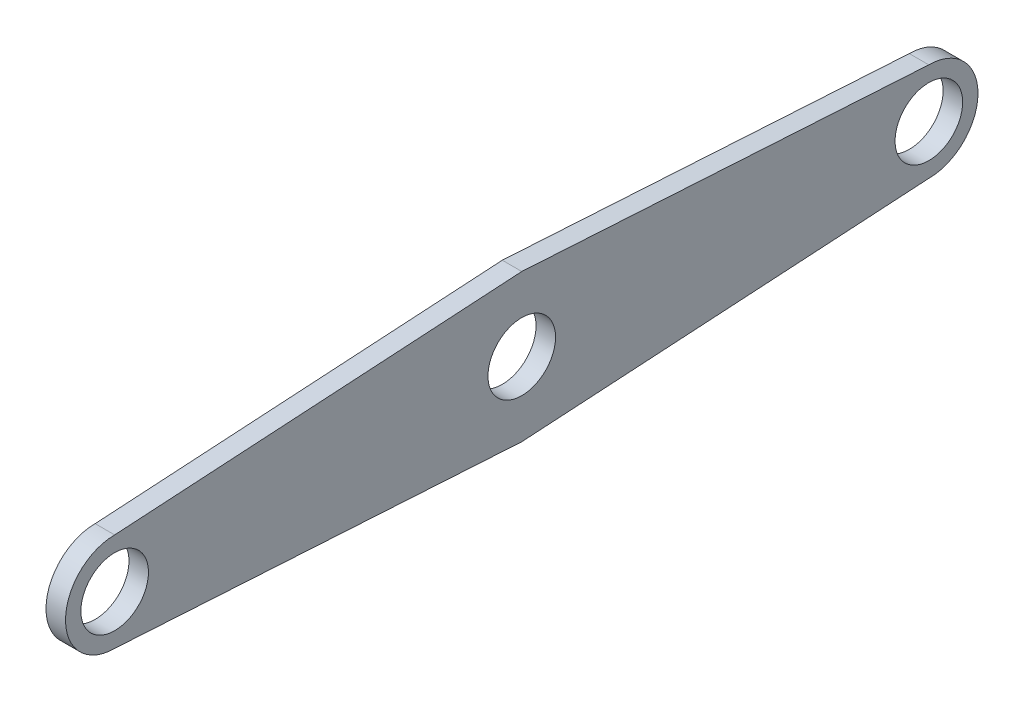
from build123d import *

# Parameters (mm, degrees)
SKETCH1_R           = 11
BOSS_EXTRUDE1_DEPTH = 6.35


with BuildPart() as part:
    # Sketch1 → Boss-Extrude1 (new body)
    with BuildSketch(Plane(origin=(0, 0, 0), x_dir=(0, 0, -1), z_dir=(1, 0, 0))):
        with BuildLine():
            Line((0, 16), (132.5, 24))
            Line((132.5, 24), (265, 16))
            ThreePointArc((265, 16), (281, 0), (265, -16))
            Line((265, -16), (132.5, -24))
            Line((132.5, -24), (0, -16))
            ThreePointArc((0, -16), (-16, 0), (0, 16))
        make_face()
        Circle(SKETCH1_R, mode=Mode.SUBTRACT)
        with Locations((265, 0)):
            Circle(SKETCH1_R, mode=Mode.SUBTRACT)
        with Locations((132.5, 0)):
            Circle(SKETCH1_R, mode=Mode.SUBTRACT)
    extrude(amount=BOSS_EXTRUDE1_DEPTH)


solid = part.part
